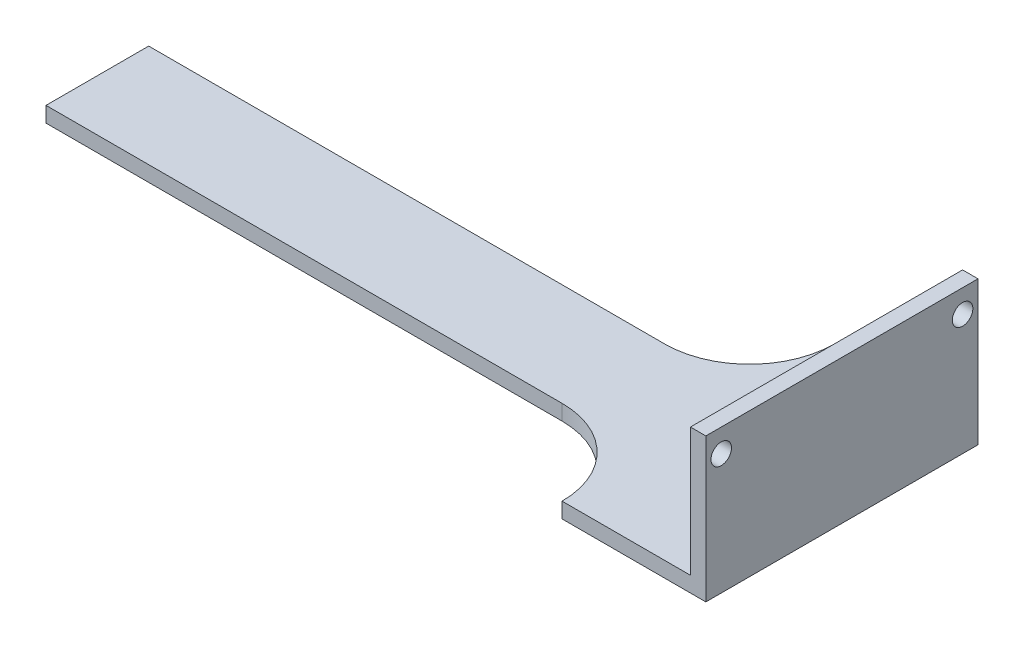
from build123d import *

# Parameters (mm, degrees)
EXTRUDE_1_DEPTH     = 3
SKETCH_2_W          = 53
SKETCH_2_H          = 28
EXTRUDE_2_DEPTH     = 3
SKETCH_3_R          = 2
CUT_EXTRUDE_1_DEPTH = 157.901242825


with BuildPart() as part:
    # 草图1 → 凸台-拉伸1 (new body)
    with BuildSketch(Plane(origin=(0, 0, 0), x_dir=(1, 0, 0), z_dir=(0, 1, 0))):
        with BuildLine():
            Line((117, 0), (142, 0))
            Line((142, 0), (142, 53))
            Line((142, 53), (117, 53))
            ThreePointArc((117, 53), (112.16726189, 41.33273811), (100.5, 36.5))
            Line((100.5, 36.5), (0, 36.5))
            Line((0, 36.5), (0, 16.5))
            Line((0, 16.5), (100.5, 16.5))
            ThreePointArc((100.5, 16.5), (112.16726189, 11.66726189), (117, 0))
        make_face()
    extrude(amount=EXTRUDE_1_DEPTH)

    # 草图2 → 凸台-拉伸2 (add)
    with BuildSketch(Plane(origin=(142, 0, 0), x_dir=(0, 0, -1), z_dir=(1, 0, 0))):
        with Locations((26.5, 14)):
            Rectangle(SKETCH_2_W, SKETCH_2_H)
    extrude(amount=EXTRUDE_2_DEPTH)

    # 草图3 → 切除-拉伸1 (cut, through all)
    with BuildSketch(Plane(origin=(145, 0, 0), x_dir=(0, 0, -1), z_dir=(1, 0, 0))):
        with Locations((50, 23.5)):
            Circle(SKETCH_3_R)
        with Locations(Location((3, 23.5, 0), (0, 0, 180))):
            Circle(SKETCH_3_R)
    extrude(amount=-CUT_EXTRUDE_1_DEPTH, mode=Mode.SUBTRACT)


solid = part.part
